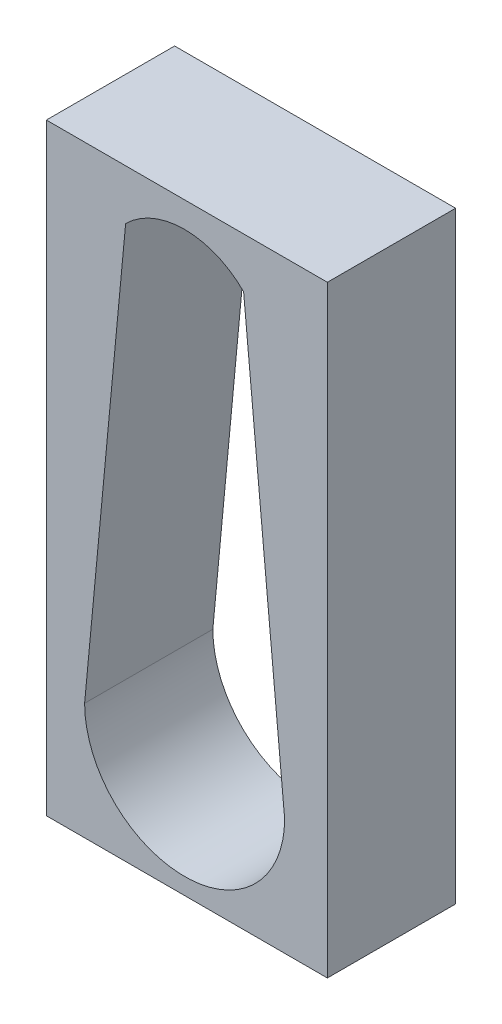
from build123d import *

# Parameters (mm, degrees)
SKETCH2_W           = 10.956492914
SKETCH2_H           = 23.495083139
BOSS_EXTRUDE1_DEPTH = 5


with BuildPart() as part:
    # Sketch2 → Boss-Extrude1 (new body)
    with BuildSketch(Plane.XY):
        with Locations((0.088180449, 7.203544187)):
            Rectangle(SKETCH2_W, SKETCH2_H)
        with BuildLine():
            Line((-3.9, 0), (-2.3, 17))
            ThreePointArc((-2.3, 17), (0, 17.952691193), (2.3, 17))
            Line((2.3, 17), (3.9, 0))
            ThreePointArc((3.9, 0), (0, -3.9), (-3.9, 0))
        make_face(mode=Mode.SUBTRACT)
    extrude(amount=BOSS_EXTRUDE1_DEPTH)


solid = part.part
